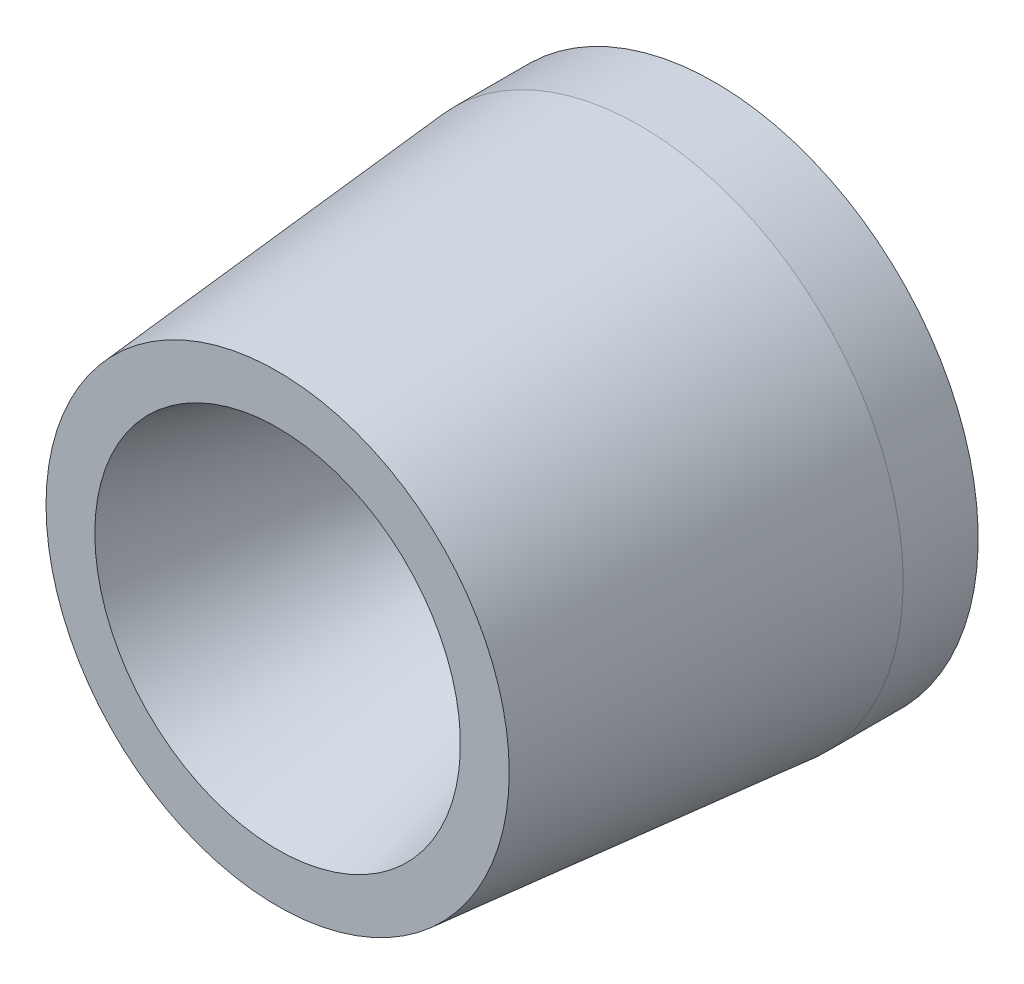
from build123d import *


with BuildPart() as part:
    # Sketch1 → Revolve1 (revolve)
    with BuildSketch(Plane(origin=(0, 0, 0), x_dir=(1, 0, 0), z_dir=(0, 1, 0)), mode=Mode.PRIVATE) as revolve1_sk:
        Polygon((44.323, 130.833403353), (44.323, 143.454534929), (18.415, 128.496544155), (18.415, 120.876544155), (32.087521299, 69.85), (38.987643543, 69.85), (39.543196557, 76.2), (39.544164949, 76.211068779), (42.87748303, 114.311068779), align=None)
    revolve(revolve1_sk.sketch.rotate(Axis((0, 0, -146.817261676), (0, 0, 1)), 180), axis=Axis((0, 0, -146.817261676), (0, 0, 1)))

    # Sketch2 → Revolve2 (revolve)
    with BuildSketch(Plane(origin=(0, 0, 0), x_dir=(1, 0, 0), z_dir=(0, 1, 0)), mode=Mode.PRIVATE) as revolve2_sk:
        Polygon((18.415, 120.876544155), (18.415, 115.969640957), (30.77272055, 69.85), (32.087521299, 69.85), align=None)
        Polygon((18.415, 129.963013839), (41.783, 143.454534929), (44.323, 143.454534929), (18.415, 128.496544155), align=None)
    revolve(revolve2_sk.sketch.rotate(Axis((0, 0, -146.817261676), (0, 0, 1)), 180), axis=Axis((0, 0, -146.817261676), (0, 0, 1)))


solid = part.part
